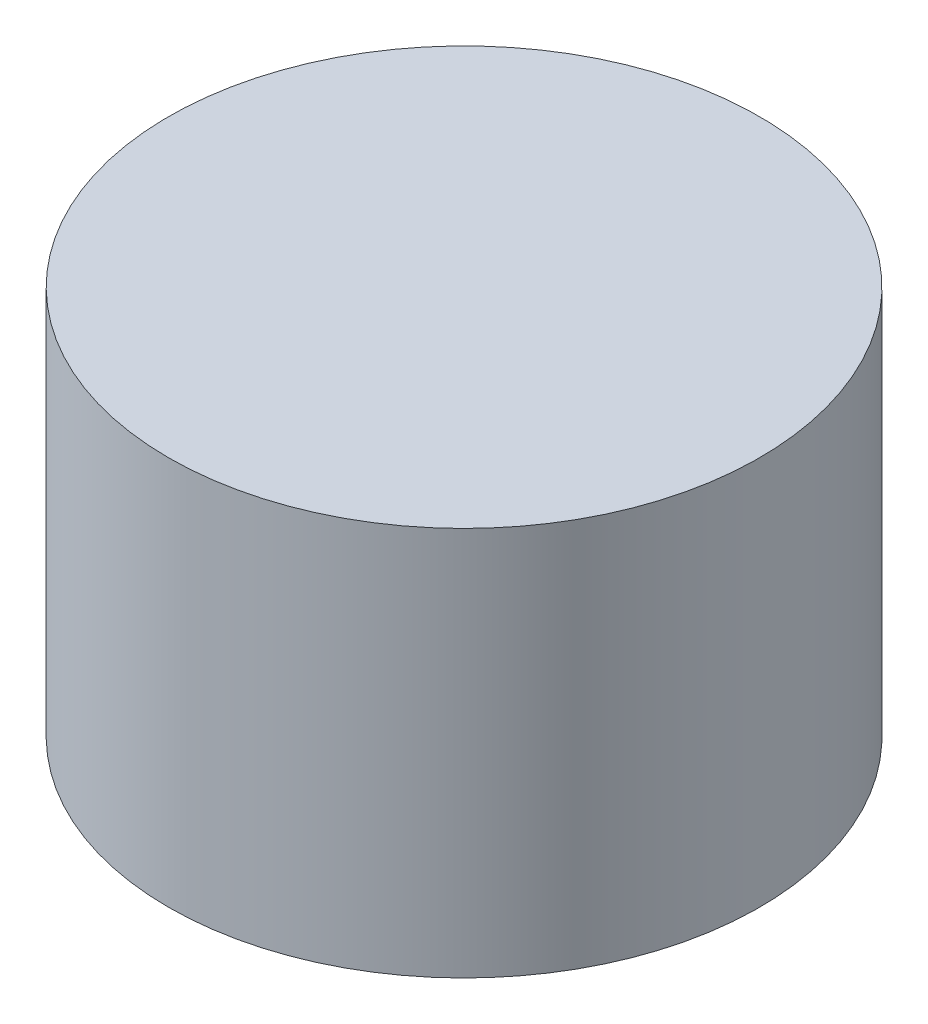
from build123d import *

# Parameters (mm, degrees)
SKETCH1_R           = 38.556184398
BOSS_EXTRUDE1_DEPTH = 50.8


with BuildPart() as part:
    # Sketch1 → Boss-Extrude1 (new body)
    with BuildSketch(Plane(origin=(0, 0, 0), x_dir=(1, 0, 0), z_dir=(0, 1, 0))):
        with Locations(Location((0, 0, 0), (0, 0, 270))):
            Circle(SKETCH1_R)
    extrude(amount=BOSS_EXTRUDE1_DEPTH)


solid = part.part
